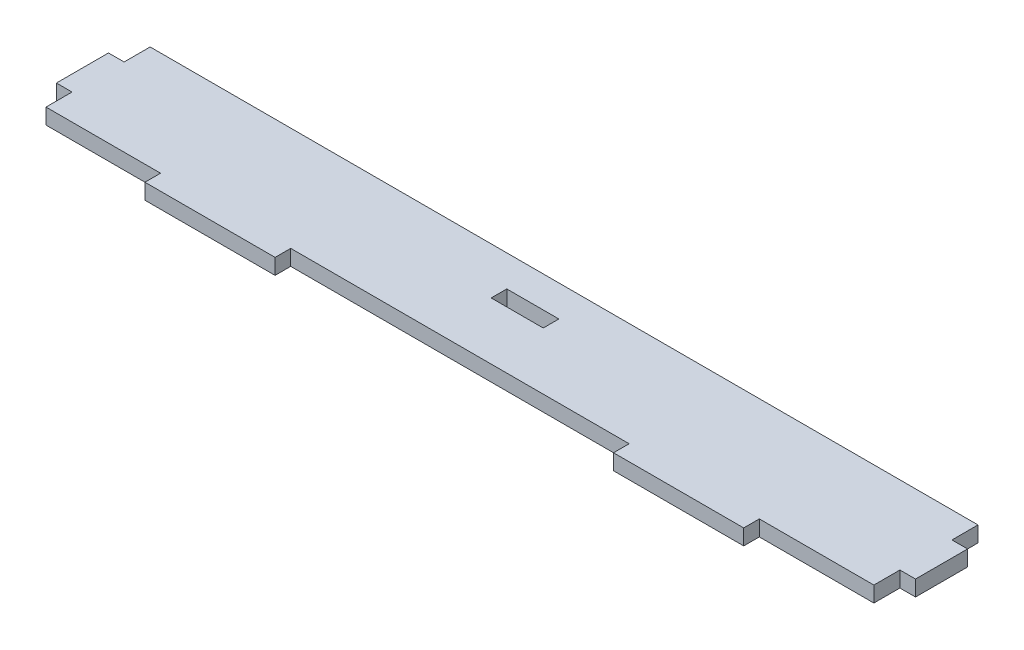
from build123d import *

# Parameters (mm, degrees)
SKETCH1_W           = 10
SKETCH1_H           = 3
BOSS_EXTRUDE1_DEPTH = 3


with BuildPart() as part:
    # Sketch1 → Boss-Extrude1 (new body)
    with BuildSketch(Plane(origin=(0, 0, 0), x_dir=(1, 0, 0), z_dir=(0, 1, 0))):
        Polygon((-79.5, 5), (-79.5, 10), (79.5, 10), (79.5, 5), (82.5, 5), (82.5, -5), (79.5, -5), (79.5, -10), (57.5, -10), (57.5, -13), (32.5, -13), (32.5, -10), (-32.5, -10), (-32.5, -13), (-57.5, -13), (-57.5, -10), (-79.5, -10), (-79.5, -5), (-82.5, -5), (-82.5, 5), align=None)
        with Locations((0, 2.5)):
            Rectangle(SKETCH1_W, SKETCH1_H, mode=Mode.SUBTRACT)
    extrude(amount=BOSS_EXTRUDE1_DEPTH)


solid = part.part
